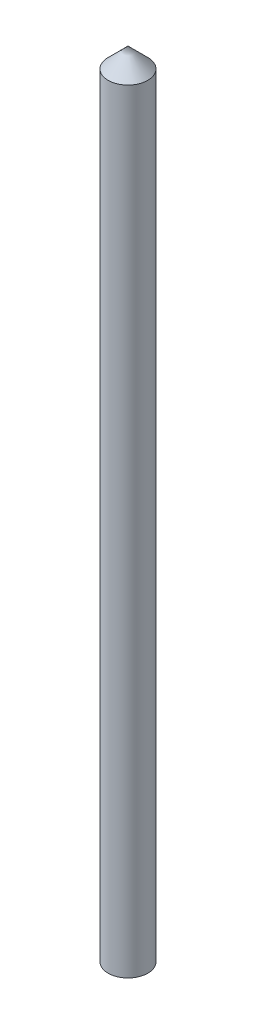
from build123d import *

# Parameters (mm, degrees)
SKETCH1_R           = 3
BOSS_EXTRUDE1_DEPTH = 120
CHAMFER1_SIZE       = 3


with BuildPart() as part:
    # Sketch1 → Boss-Extrude1 (new body)
    with BuildSketch(Plane(origin=(0, 0, 0), x_dir=(1, 0, 0), z_dir=(0, 1, 0))):
        with Locations(Location((0, 0, 0), (0, 0, 270))):
            Circle(SKETCH1_R)
    extrude(amount=BOSS_EXTRUDE1_DEPTH)

    # Chamfer1
    chamfer1_edges = [part.edges().sort_by_distance(p)[0] for p in [
        (0, 120, -3),
    ]]
    chamfer(chamfer1_edges, length=CHAMFER1_SIZE)


solid = part.part
